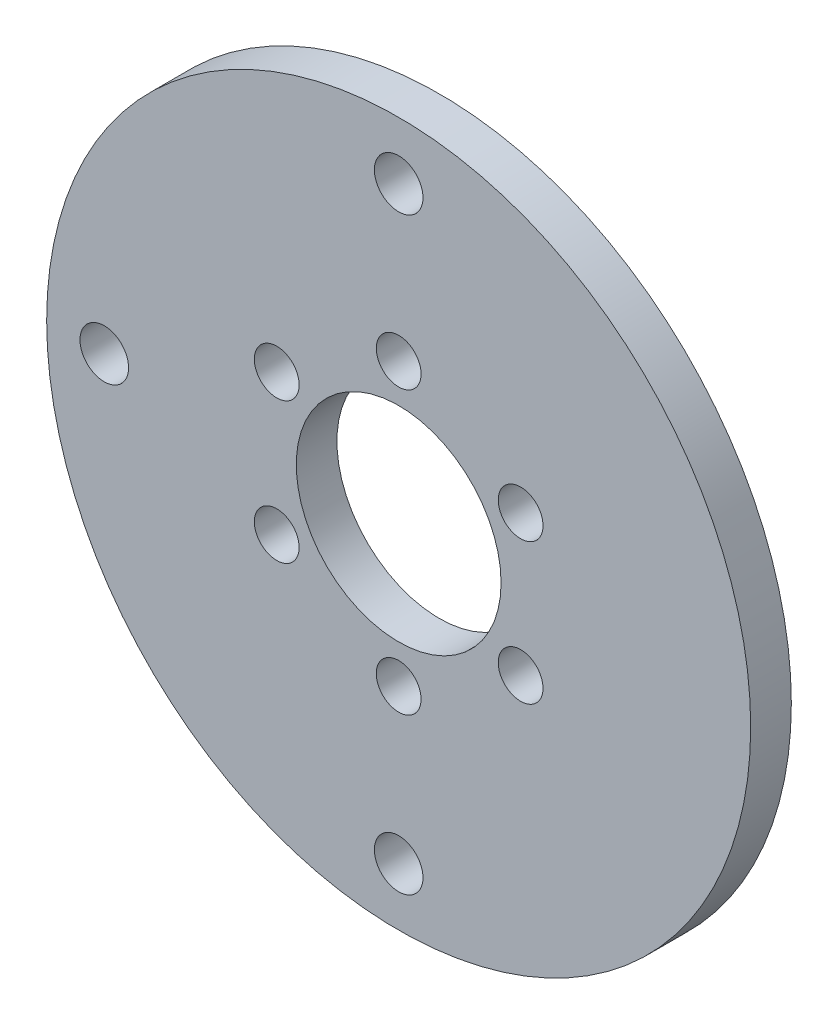
from build123d import *

# Parameters (mm, degrees)
SKETCH1_R           = 27.5
SKETCH1_R_2         = 8
SKETCH1_R_3         = 1.89865
SKETCH1_R_4         = 1.75
BOSS_EXTRUDE1_DEPTH = 3.175


with BuildPart() as part:
    # Sketch1 → Boss-Extrude1 (new body)
    with BuildSketch(Plane.XY):
        Circle(SKETCH1_R)
        Circle(SKETCH1_R_2, mode=Mode.SUBTRACT)
        with Locations((0, 23)):
            Circle(SKETCH1_R_3, mode=Mode.SUBTRACT)
        with Locations((0, -23)):
            Circle(SKETCH1_R_3, mode=Mode.SUBTRACT)
        with Locations((-23, 0)):
            Circle(SKETCH1_R_3, mode=Mode.SUBTRACT)
        with Locations((0, 11)):
            Circle(SKETCH1_R_4, mode=Mode.SUBTRACT)
        with Locations((9.526279442, 5.5)):
            Circle(SKETCH1_R_4, mode=Mode.SUBTRACT)
        with Locations((9.526279442, -5.5)):
            Circle(SKETCH1_R_4, mode=Mode.SUBTRACT)
        with Locations((0, -11)):
            Circle(SKETCH1_R_4, mode=Mode.SUBTRACT)
        with Locations((-9.526279442, -5.5)):
            Circle(SKETCH1_R_4, mode=Mode.SUBTRACT)
        with Locations((-9.526279442, 5.5)):
            Circle(SKETCH1_R_4, mode=Mode.SUBTRACT)
    extrude(amount=BOSS_EXTRUDE1_DEPTH)


solid = part.part
